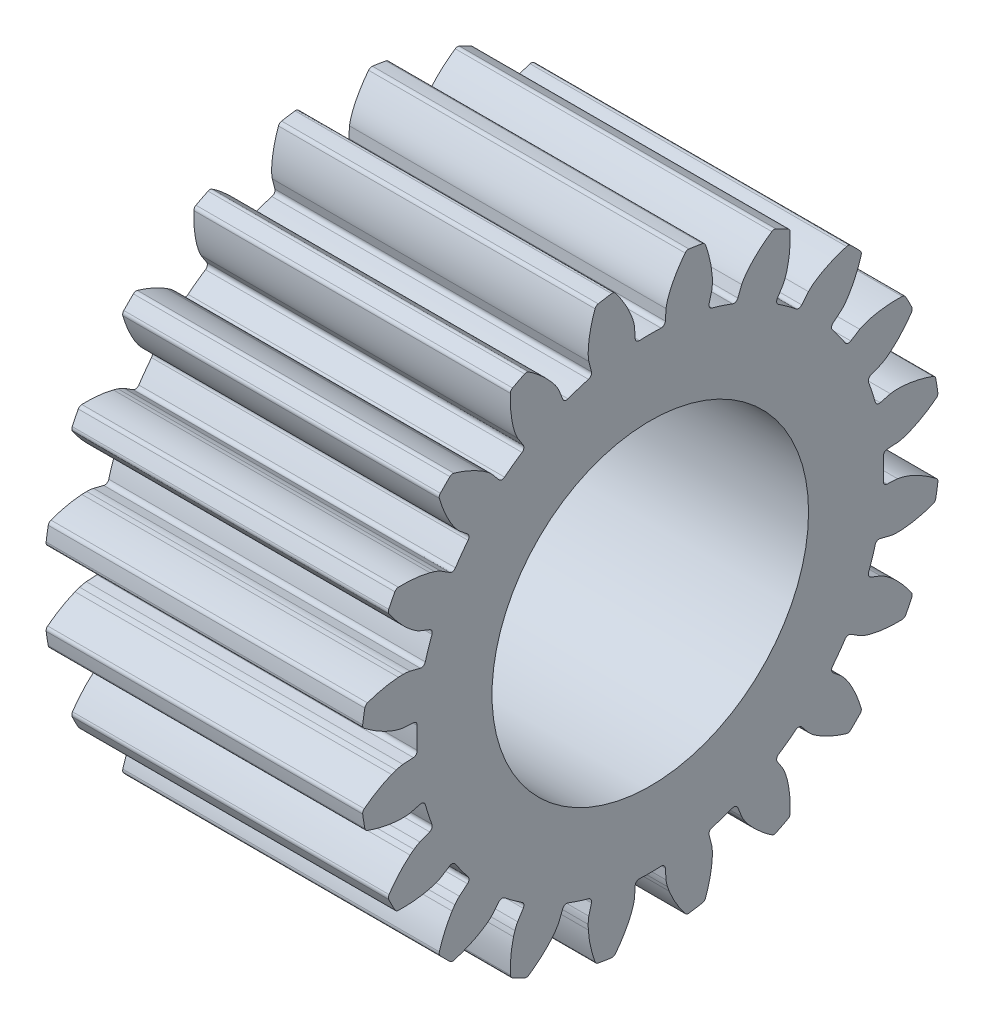
from build123d import *

# Parameters (mm, degrees)
SKETCH2_R                      = 11.641666667
SKETCH2_R_2                    = 6.35
GEAR_WIDTH_EXTRUDE_DEPTH       = 12.7
GEAR_TOOTH_CUT_DEPTH           = 25.4
TOOTH_FILLETS_R                = 0.166158333
CIRPATTERN1_COUNT              = 20
CIRPATTERN1_COPY_1_DEPTH       = 25.4
CIRPATTERN1_COPY_2_DEPTH       = 25.4
CIRPATTERN1_COPY_3_DEPTH       = 25.4
CIRPATTERN1_COPY_4_DEPTH       = 25.4
CIRPATTERN1_COPY_5_DEPTH       = 25.4
CIRPATTERN1_COPY_6_DEPTH       = 25.4
CIRPATTERN1_COPY_7_DEPTH       = 25.4
CIRPATTERN1_COPY_8_DEPTH       = 25.4
CIRPATTERN1_COPY_9_DEPTH       = 25.4
CIRPATTERN1_COPY_10_DEPTH      = 25.4
CIRPATTERN1_COPY_11_DEPTH      = 25.4
CIRPATTERN1_COPY_12_DEPTH      = 25.4
CIRPATTERN1_COPY_13_DEPTH      = 25.4
CIRPATTERN1_COPY_14_DEPTH      = 25.4
CIRPATTERN1_COPY_15_DEPTH      = 25.4
CIRPATTERN1_COPY_16_DEPTH      = 25.4
CIRPATTERN1_COPY_17_DEPTH      = 25.4
CIRPATTERN1_COPY_18_DEPTH      = 25.4
CIRPATTERN1_COPY_19_DEPTH      = 25.4
TOOTH_FILLETS_OF_CIRPATTERN1_R = 0.166158333


with BuildPart() as part:
    # Sketch2 → Gear Width Extrude (new body)
    with BuildSketch(Plane.YZ):
        with Locations(Location((0, 0, 0), (0, 0, 270))):
            Circle(SKETCH2_R)
        with Locations(Location((0, 0, 0), (0, 0, 270))):
            Circle(SKETCH2_R_2, mode=Mode.SUBTRACT)
    extrude(amount=GEAR_WIDTH_EXTRUDE_DEPTH)

    # Sketch3 → Gear Tooth Cut (cut)
    with BuildSketch(Plane.YZ):
        with BuildLine():
            Line((9.358841667, 0), (11.641666667, 0))
            ThreePointArc((11.641666667, 0), (11.618756416, 0.730001453), (11.550115837, 1.457129688))
            add(Edge.make_bspline(
                [(9.924950887, 0.632432444), (9.927665709, 0.632640558), (9.935271977, 0.633332523), (9.958708221, 0.636167814), (10.004748972, 0.643723264), (10.061265669, 0.655862457), (10.125884242, 0.672498541), (10.18790775, 0.690656099), (10.240712879, 0.707481051), (10.293164878, 0.725471798), (10.345204029, 0.744480059), (10.407974795, 0.768785256), (10.482864008, 0.799706671), (10.56980499, 0.838426343), (10.667678091, 0.885373081), (10.76659038, 0.936443394), (10.863213861, 0.989339672), (10.959973929, 1.045801989), (11.052977814, 1.102569368), (11.148631538, 1.16459707), (11.236446312, 1.223412483), (11.333722057, 1.292669638), (11.411905495, 1.349545176), (11.49170588, 1.411081623), (11.530401372, 1.441441608), (11.550115837, 1.457129688)],
                knots=[0, 0, 0, 0, 0, 0.005376749, 0.015083688, 0.04661014, 0.092110526, 0.119476176, 0.146842496, 0.174208854, 0.201574956, 0.228941013, 0.256307345, 0.307035032, 0.361767352, 0.416499661, 0.471231937, 0.525964282, 0.580696616, 0.635428982, 0.690161387, 0.744893688, 0.799626082, 0.854358407, 0.909090915, 0.909090915, 0.909090915, 0.909090915, 0.909090915], degree=4))
            Line((9.924950887, 0.632432444), (9.339898894, 0.595152072))
            ThreePointArc((9.339898894, 0.595152072), (9.354104775, 0.297726728), (9.358841667, 0))
        make_face()
    gear_tooth_cut = extrude(amount=GEAR_TOOTH_CUT_DEPTH, mode=Mode.SUBTRACT)

    # Gear Tooth Cut Mirror: Gear Tooth Cut across Front Plane
    add(gear_tooth_cut.mirror(Plane.XY), mode=Mode.SUBTRACT)

    # Tooth Fillets
    tooth_fillets_edges = [part.edges().sort_by_distance(p)[0] for p in [
        (6.35, 11.550115837, 1.457129688),
        (6.35, 11.550115837, -1.457129688),
        (6.35, 9.339898894, 0.595152072),
        (6.35, 9.339898894, -0.595152072),
    ]]
    fillet(tooth_fillets_edges, radius=TOOTH_FILLETS_R)

    # CirPattern1: Gear Tooth Cut ×20 about axis
    cirpattern1_axis = Axis((0, 0, 0), (1, 0, 0))
    for i in range(1, CIRPATTERN1_COUNT):
        add(gear_tooth_cut.rotate(cirpattern1_axis, i * 360 / CIRPATTERN1_COUNT), mode=Mode.SUBTRACT)

    # CirPattern1 copy 1 sketch → CirPattern1 copy 1 (cut)
    with BuildSketch(Plane(origin=(0, 0, 0), x_dir=(0, 0.9510565162951535, 0.3090169943749474), z_dir=(1, 0, 0))):
        with BuildLine():
            Line((9.358841667, 0), (11.641666667, 0))
            ThreePointArc((11.641666667, 0), (11.618756416, -0.730001453), (11.550115837, -1.457129688))
            add(Edge.make_bspline(
                [(9.924950887, -0.632432444), (9.927665709, -0.632640558), (9.935271977, -0.633332523), (9.958708221, -0.636167814), (10.004748972, -0.643723264), (10.061265669, -0.655862457), (10.125884242, -0.672498541), (10.18790775, -0.690656099), (10.240712879, -0.707481051), (10.293164878, -0.725471798), (10.345204029, -0.744480059), (10.407974795, -0.768785256), (10.482864008, -0.799706671), (10.56980499, -0.838426343), (10.667678091, -0.885373081), (10.76659038, -0.936443394), (10.863213861, -0.989339672), (10.959973929, -1.045801989), (11.052977814, -1.102569368), (11.148631538, -1.16459707), (11.236446312, -1.223412483), (11.333722057, -1.292669638), (11.411905495, -1.349545176), (11.49170588, -1.411081623), (11.530401372, -1.441441608), (11.550115837, -1.457129688)],
                knots=[0, 0, 0, 0, 0, 0.005376749, 0.015083688, 0.04661014, 0.092110526, 0.119476176, 0.146842496, 0.174208854, 0.201574956, 0.228941013, 0.256307345, 0.307035032, 0.361767352, 0.416499661, 0.471231937, 0.525964282, 0.580696616, 0.635428982, 0.690161387, 0.744893688, 0.799626082, 0.854358407, 0.909090915, 0.909090915, 0.909090915, 0.909090915, 0.909090915], degree=4))
            Line((9.924950887, -0.632432444), (9.339898894, -0.595152072))
            ThreePointArc((9.339898894, -0.595152072), (9.354104775, -0.297726728), (9.358841667, 0))
        make_face()
    extrude(amount=CIRPATTERN1_COPY_1_DEPTH, mode=Mode.SUBTRACT)

    # CirPattern1 copy 2 sketch → CirPattern1 copy 2 (cut)
    with BuildSketch(Plane(origin=(0, 0, 0), x_dir=(0, 0.8090169943749475, 0.5877852522924731), z_dir=(1, 0, 0))):
        with BuildLine():
            Line((9.358841667, 0), (11.641666667, 0))
            ThreePointArc((11.641666667, 0), (11.618756416, -0.730001453), (11.550115837, -1.457129688))
            add(Edge.make_bspline(
                [(9.924950887, -0.632432444), (9.927665709, -0.632640558), (9.935271977, -0.633332523), (9.958708221, -0.636167814), (10.004748972, -0.643723264), (10.061265669, -0.655862457), (10.125884242, -0.672498541), (10.18790775, -0.690656099), (10.240712879, -0.707481051), (10.293164878, -0.725471798), (10.345204029, -0.744480059), (10.407974795, -0.768785256), (10.482864008, -0.799706671), (10.56980499, -0.838426343), (10.667678091, -0.885373081), (10.76659038, -0.936443394), (10.863213861, -0.989339672), (10.959973929, -1.045801989), (11.052977814, -1.102569368), (11.148631538, -1.16459707), (11.236446312, -1.223412483), (11.333722057, -1.292669638), (11.411905495, -1.349545176), (11.49170588, -1.411081623), (11.530401372, -1.441441608), (11.550115837, -1.457129688)],
                knots=[0, 0, 0, 0, 0, 0.005376749, 0.015083688, 0.04661014, 0.092110526, 0.119476176, 0.146842496, 0.174208854, 0.201574956, 0.228941013, 0.256307345, 0.307035032, 0.361767352, 0.416499661, 0.471231937, 0.525964282, 0.580696616, 0.635428982, 0.690161387, 0.744893688, 0.799626082, 0.854358407, 0.909090915, 0.909090915, 0.909090915, 0.909090915, 0.909090915], degree=4))
            Line((9.924950887, -0.632432444), (9.339898894, -0.595152072))
            ThreePointArc((9.339898894, -0.595152072), (9.354104775, -0.297726728), (9.358841667, 0))
        make_face()
    extrude(amount=CIRPATTERN1_COPY_2_DEPTH, mode=Mode.SUBTRACT)

    # CirPattern1 copy 3 sketch → CirPattern1 copy 3 (cut)
    with BuildSketch(Plane(origin=(0, 0, 0), x_dir=(0, 0.5877852522924731, 0.8090169943749475), z_dir=(1, 0, 0))):
        with BuildLine():
            Line((9.358841667, 0), (11.641666667, 0))
            ThreePointArc((11.641666667, 0), (11.618756416, -0.730001453), (11.550115837, -1.457129688))
            add(Edge.make_bspline(
                [(9.924950887, -0.632432444), (9.927665709, -0.632640558), (9.935271977, -0.633332523), (9.958708221, -0.636167814), (10.004748972, -0.643723264), (10.061265669, -0.655862457), (10.125884242, -0.672498541), (10.18790775, -0.690656099), (10.240712879, -0.707481051), (10.293164878, -0.725471798), (10.345204029, -0.744480059), (10.407974795, -0.768785256), (10.482864008, -0.799706671), (10.56980499, -0.838426343), (10.667678091, -0.885373081), (10.76659038, -0.936443394), (10.863213861, -0.989339672), (10.959973929, -1.045801989), (11.052977814, -1.102569368), (11.148631538, -1.16459707), (11.236446312, -1.223412483), (11.333722057, -1.292669638), (11.411905495, -1.349545176), (11.49170588, -1.411081623), (11.530401372, -1.441441608), (11.550115837, -1.457129688)],
                knots=[0, 0, 0, 0, 0, 0.005376749, 0.015083688, 0.04661014, 0.092110526, 0.119476176, 0.146842496, 0.174208854, 0.201574956, 0.228941013, 0.256307345, 0.307035032, 0.361767352, 0.416499661, 0.471231937, 0.525964282, 0.580696616, 0.635428982, 0.690161387, 0.744893688, 0.799626082, 0.854358407, 0.909090915, 0.909090915, 0.909090915, 0.909090915, 0.909090915], degree=4))
            Line((9.924950887, -0.632432444), (9.339898894, -0.595152072))
            ThreePointArc((9.339898894, -0.595152072), (9.354104775, -0.297726728), (9.358841667, 0))
        make_face()
    extrude(amount=CIRPATTERN1_COPY_3_DEPTH, mode=Mode.SUBTRACT)

    # CirPattern1 copy 4 sketch → CirPattern1 copy 4 (cut)
    with BuildSketch(Plane(origin=(0, 0, 0), x_dir=(0, 0.30901699437494745, 0.9510565162951535), z_dir=(1, 0, 0))):
        with BuildLine():
            Line((9.358841667, 0), (11.641666667, 0))
            ThreePointArc((11.641666667, 0), (11.618756416, -0.730001453), (11.550115837, -1.457129688))
            add(Edge.make_bspline(
                [(9.924950887, -0.632432444), (9.927665709, -0.632640558), (9.935271977, -0.633332523), (9.958708221, -0.636167814), (10.004748972, -0.643723264), (10.061265669, -0.655862457), (10.125884242, -0.672498541), (10.18790775, -0.690656099), (10.240712879, -0.707481051), (10.293164878, -0.725471798), (10.345204029, -0.744480059), (10.407974795, -0.768785256), (10.482864008, -0.799706671), (10.56980499, -0.838426343), (10.667678091, -0.885373081), (10.76659038, -0.936443394), (10.863213861, -0.989339672), (10.959973929, -1.045801989), (11.052977814, -1.102569368), (11.148631538, -1.16459707), (11.236446312, -1.223412483), (11.333722057, -1.292669638), (11.411905495, -1.349545176), (11.49170588, -1.411081623), (11.530401372, -1.441441608), (11.550115837, -1.457129688)],
                knots=[0, 0, 0, 0, 0, 0.005376749, 0.015083688, 0.04661014, 0.092110526, 0.119476176, 0.146842496, 0.174208854, 0.201574956, 0.228941013, 0.256307345, 0.307035032, 0.361767352, 0.416499661, 0.471231937, 0.525964282, 0.580696616, 0.635428982, 0.690161387, 0.744893688, 0.799626082, 0.854358407, 0.909090915, 0.909090915, 0.909090915, 0.909090915, 0.909090915], degree=4))
            Line((9.924950887, -0.632432444), (9.339898894, -0.595152072))
            ThreePointArc((9.339898894, -0.595152072), (9.354104775, -0.297726728), (9.358841667, 0))
        make_face()
    extrude(amount=CIRPATTERN1_COPY_4_DEPTH, mode=Mode.SUBTRACT)

    # CirPattern1 copy 5 sketch → CirPattern1 copy 5 (cut)
    with BuildSketch(Plane(origin=(0, 0, 0), x_dir=(0, 0, 1), z_dir=(1, 0, 0))):
        with BuildLine():
            Line((9.358841667, 0), (11.641666667, 0))
            ThreePointArc((11.641666667, 0), (11.618756416, -0.730001453), (11.550115837, -1.457129688))
            add(Edge.make_bspline(
                [(9.924950887, -0.632432444), (9.927665709, -0.632640558), (9.935271977, -0.633332523), (9.958708221, -0.636167814), (10.004748972, -0.643723264), (10.061265669, -0.655862457), (10.125884242, -0.672498541), (10.18790775, -0.690656099), (10.240712879, -0.707481051), (10.293164878, -0.725471798), (10.345204029, -0.744480059), (10.407974795, -0.768785256), (10.482864008, -0.799706671), (10.56980499, -0.838426343), (10.667678091, -0.885373081), (10.76659038, -0.936443394), (10.863213861, -0.989339672), (10.959973929, -1.045801989), (11.052977814, -1.102569368), (11.148631538, -1.16459707), (11.236446312, -1.223412483), (11.333722057, -1.292669638), (11.411905495, -1.349545176), (11.49170588, -1.411081623), (11.530401372, -1.441441608), (11.550115837, -1.457129688)],
                knots=[0, 0, 0, 0, 0, 0.005376749, 0.015083688, 0.04661014, 0.092110526, 0.119476176, 0.146842496, 0.174208854, 0.201574956, 0.228941013, 0.256307345, 0.307035032, 0.361767352, 0.416499661, 0.471231937, 0.525964282, 0.580696616, 0.635428982, 0.690161387, 0.744893688, 0.799626082, 0.854358407, 0.909090915, 0.909090915, 0.909090915, 0.909090915, 0.909090915], degree=4))
            Line((9.924950887, -0.632432444), (9.339898894, -0.595152072))
            ThreePointArc((9.339898894, -0.595152072), (9.354104775, -0.297726728), (9.358841667, 0))
        make_face()
    extrude(amount=CIRPATTERN1_COPY_5_DEPTH, mode=Mode.SUBTRACT)

    # CirPattern1 copy 6 sketch → CirPattern1 copy 6 (cut)
    with BuildSketch(Plane(origin=(0, 0, 0), x_dir=(0, -0.30901699437494734, 0.9510565162951536), z_dir=(1, 0, 0))):
        with BuildLine():
            Line((9.358841667, 0), (11.641666667, 0))
            ThreePointArc((11.641666667, 0), (11.618756416, -0.730001453), (11.550115837, -1.457129688))
            add(Edge.make_bspline(
                [(9.924950887, -0.632432444), (9.927665709, -0.632640558), (9.935271977, -0.633332523), (9.958708221, -0.636167814), (10.004748972, -0.643723264), (10.061265669, -0.655862457), (10.125884242, -0.672498541), (10.18790775, -0.690656099), (10.240712879, -0.707481051), (10.293164878, -0.725471798), (10.345204029, -0.744480059), (10.407974795, -0.768785256), (10.482864008, -0.799706671), (10.56980499, -0.838426343), (10.667678091, -0.885373081), (10.76659038, -0.936443394), (10.863213861, -0.989339672), (10.959973929, -1.045801989), (11.052977814, -1.102569368), (11.148631538, -1.16459707), (11.236446312, -1.223412483), (11.333722057, -1.292669638), (11.411905495, -1.349545176), (11.49170588, -1.411081623), (11.530401372, -1.441441608), (11.550115837, -1.457129688)],
                knots=[0, 0, 0, 0, 0, 0.005376749, 0.015083688, 0.04661014, 0.092110526, 0.119476176, 0.146842496, 0.174208854, 0.201574956, 0.228941013, 0.256307345, 0.307035032, 0.361767352, 0.416499661, 0.471231937, 0.525964282, 0.580696616, 0.635428982, 0.690161387, 0.744893688, 0.799626082, 0.854358407, 0.909090915, 0.909090915, 0.909090915, 0.909090915, 0.909090915], degree=4))
            Line((9.924950887, -0.632432444), (9.339898894, -0.595152072))
            ThreePointArc((9.339898894, -0.595152072), (9.354104775, -0.297726728), (9.358841667, 0))
        make_face()
    extrude(amount=CIRPATTERN1_COPY_6_DEPTH, mode=Mode.SUBTRACT)

    # CirPattern1 copy 7 sketch → CirPattern1 copy 7 (cut)
    with BuildSketch(Plane(origin=(0, 0, 0), x_dir=(0, -0.587785252292473, 0.8090169943749475), z_dir=(1, 0, 0))):
        with BuildLine():
            Line((9.358841667, 0), (11.641666667, 0))
            ThreePointArc((11.641666667, 0), (11.618756416, -0.730001453), (11.550115837, -1.457129688))
            add(Edge.make_bspline(
                [(9.924950887, -0.632432444), (9.927665709, -0.632640558), (9.935271977, -0.633332523), (9.958708221, -0.636167814), (10.004748972, -0.643723264), (10.061265669, -0.655862457), (10.125884242, -0.672498541), (10.18790775, -0.690656099), (10.240712879, -0.707481051), (10.293164878, -0.725471798), (10.345204029, -0.744480059), (10.407974795, -0.768785256), (10.482864008, -0.799706671), (10.56980499, -0.838426343), (10.667678091, -0.885373081), (10.76659038, -0.936443394), (10.863213861, -0.989339672), (10.959973929, -1.045801989), (11.052977814, -1.102569368), (11.148631538, -1.16459707), (11.236446312, -1.223412483), (11.333722057, -1.292669638), (11.411905495, -1.349545176), (11.49170588, -1.411081623), (11.530401372, -1.441441608), (11.550115837, -1.457129688)],
                knots=[0, 0, 0, 0, 0, 0.005376749, 0.015083688, 0.04661014, 0.092110526, 0.119476176, 0.146842496, 0.174208854, 0.201574956, 0.228941013, 0.256307345, 0.307035032, 0.361767352, 0.416499661, 0.471231937, 0.525964282, 0.580696616, 0.635428982, 0.690161387, 0.744893688, 0.799626082, 0.854358407, 0.909090915, 0.909090915, 0.909090915, 0.909090915, 0.909090915], degree=4))
            Line((9.924950887, -0.632432444), (9.339898894, -0.595152072))
            ThreePointArc((9.339898894, -0.595152072), (9.354104775, -0.297726728), (9.358841667, 0))
        make_face()
    extrude(amount=CIRPATTERN1_COPY_7_DEPTH, mode=Mode.SUBTRACT)

    # CirPattern1 copy 8 sketch → CirPattern1 copy 8 (cut)
    with BuildSketch(Plane(origin=(0, 0, 0), x_dir=(0, -0.8090169943749473, 0.5877852522924732), z_dir=(1, 0, 0))):
        with BuildLine():
            Line((9.358841667, 0), (11.641666667, 0))
            ThreePointArc((11.641666667, 0), (11.618756416, -0.730001453), (11.550115837, -1.457129688))
            add(Edge.make_bspline(
                [(9.924950887, -0.632432444), (9.927665709, -0.632640558), (9.935271977, -0.633332523), (9.958708221, -0.636167814), (10.004748972, -0.643723264), (10.061265669, -0.655862457), (10.125884242, -0.672498541), (10.18790775, -0.690656099), (10.240712879, -0.707481051), (10.293164878, -0.725471798), (10.345204029, -0.744480059), (10.407974795, -0.768785256), (10.482864008, -0.799706671), (10.56980499, -0.838426343), (10.667678091, -0.885373081), (10.76659038, -0.936443394), (10.863213861, -0.989339672), (10.959973929, -1.045801989), (11.052977814, -1.102569368), (11.148631538, -1.16459707), (11.236446312, -1.223412483), (11.333722057, -1.292669638), (11.411905495, -1.349545176), (11.49170588, -1.411081623), (11.530401372, -1.441441608), (11.550115837, -1.457129688)],
                knots=[0, 0, 0, 0, 0, 0.005376749, 0.015083688, 0.04661014, 0.092110526, 0.119476176, 0.146842496, 0.174208854, 0.201574956, 0.228941013, 0.256307345, 0.307035032, 0.361767352, 0.416499661, 0.471231937, 0.525964282, 0.580696616, 0.635428982, 0.690161387, 0.744893688, 0.799626082, 0.854358407, 0.909090915, 0.909090915, 0.909090915, 0.909090915, 0.909090915], degree=4))
            Line((9.924950887, -0.632432444), (9.339898894, -0.595152072))
            ThreePointArc((9.339898894, -0.595152072), (9.354104775, -0.297726728), (9.358841667, 0))
        make_face()
    extrude(amount=CIRPATTERN1_COPY_8_DEPTH, mode=Mode.SUBTRACT)

    # CirPattern1 copy 9 sketch → CirPattern1 copy 9 (cut)
    with BuildSketch(Plane(origin=(0, 0, 0), x_dir=(0, -0.9510565162951535, 0.3090169943749475), z_dir=(1, 0, 0))):
        with BuildLine():
            Line((9.358841667, 0), (11.641666667, 0))
            ThreePointArc((11.641666667, 0), (11.618756416, -0.730001453), (11.550115837, -1.457129688))
            add(Edge.make_bspline(
                [(9.924950887, -0.632432444), (9.927665709, -0.632640558), (9.935271977, -0.633332523), (9.958708221, -0.636167814), (10.004748972, -0.643723264), (10.061265669, -0.655862457), (10.125884242, -0.672498541), (10.18790775, -0.690656099), (10.240712879, -0.707481051), (10.293164878, -0.725471798), (10.345204029, -0.744480059), (10.407974795, -0.768785256), (10.482864008, -0.799706671), (10.56980499, -0.838426343), (10.667678091, -0.885373081), (10.76659038, -0.936443394), (10.863213861, -0.989339672), (10.959973929, -1.045801989), (11.052977814, -1.102569368), (11.148631538, -1.16459707), (11.236446312, -1.223412483), (11.333722057, -1.292669638), (11.411905495, -1.349545176), (11.49170588, -1.411081623), (11.530401372, -1.441441608), (11.550115837, -1.457129688)],
                knots=[0, 0, 0, 0, 0, 0.005376749, 0.015083688, 0.04661014, 0.092110526, 0.119476176, 0.146842496, 0.174208854, 0.201574956, 0.228941013, 0.256307345, 0.307035032, 0.361767352, 0.416499661, 0.471231937, 0.525964282, 0.580696616, 0.635428982, 0.690161387, 0.744893688, 0.799626082, 0.854358407, 0.909090915, 0.909090915, 0.909090915, 0.909090915, 0.909090915], degree=4))
            Line((9.924950887, -0.632432444), (9.339898894, -0.595152072))
            ThreePointArc((9.339898894, -0.595152072), (9.354104775, -0.297726728), (9.358841667, 0))
        make_face()
    extrude(amount=CIRPATTERN1_COPY_9_DEPTH, mode=Mode.SUBTRACT)

    # CirPattern1 copy 10 sketch → CirPattern1 copy 10 (cut)
    with BuildSketch(Plane(origin=(0, 0, 0), x_dir=(0, -1, 0), z_dir=(1, 0, 0))):
        with BuildLine():
            Line((9.358841667, 0), (11.641666667, 0))
            ThreePointArc((11.641666667, 0), (11.618756416, -0.730001453), (11.550115837, -1.457129688))
            add(Edge.make_bspline(
                [(9.924950887, -0.632432444), (9.927665709, -0.632640558), (9.935271977, -0.633332523), (9.958708221, -0.636167814), (10.004748972, -0.643723264), (10.061265669, -0.655862457), (10.125884242, -0.672498541), (10.18790775, -0.690656099), (10.240712879, -0.707481051), (10.293164878, -0.725471798), (10.345204029, -0.744480059), (10.407974795, -0.768785256), (10.482864008, -0.799706671), (10.56980499, -0.838426343), (10.667678091, -0.885373081), (10.76659038, -0.936443394), (10.863213861, -0.989339672), (10.959973929, -1.045801989), (11.052977814, -1.102569368), (11.148631538, -1.16459707), (11.236446312, -1.223412483), (11.333722057, -1.292669638), (11.411905495, -1.349545176), (11.49170588, -1.411081623), (11.530401372, -1.441441608), (11.550115837, -1.457129688)],
                knots=[0, 0, 0, 0, 0, 0.005376749, 0.015083688, 0.04661014, 0.092110526, 0.119476176, 0.146842496, 0.174208854, 0.201574956, 0.228941013, 0.256307345, 0.307035032, 0.361767352, 0.416499661, 0.471231937, 0.525964282, 0.580696616, 0.635428982, 0.690161387, 0.744893688, 0.799626082, 0.854358407, 0.909090915, 0.909090915, 0.909090915, 0.909090915, 0.909090915], degree=4))
            Line((9.924950887, -0.632432444), (9.339898894, -0.595152072))
            ThreePointArc((9.339898894, -0.595152072), (9.354104775, -0.297726728), (9.358841667, 0))
        make_face()
    extrude(amount=CIRPATTERN1_COPY_10_DEPTH, mode=Mode.SUBTRACT)

    # CirPattern1 copy 11 sketch → CirPattern1 copy 11 (cut)
    with BuildSketch(Plane(origin=(0, 0, 0), x_dir=(0, -0.9510565162951536, -0.3090169943749473), z_dir=(1, 0, 0))):
        with BuildLine():
            Line((9.358841667, 0), (11.641666667, 0))
            ThreePointArc((11.641666667, 0), (11.618756416, -0.730001453), (11.550115837, -1.457129688))
            add(Edge.make_bspline(
                [(9.924950887, -0.632432444), (9.927665709, -0.632640558), (9.935271977, -0.633332523), (9.958708221, -0.636167814), (10.004748972, -0.643723264), (10.061265669, -0.655862457), (10.125884242, -0.672498541), (10.18790775, -0.690656099), (10.240712879, -0.707481051), (10.293164878, -0.725471798), (10.345204029, -0.744480059), (10.407974795, -0.768785256), (10.482864008, -0.799706671), (10.56980499, -0.838426343), (10.667678091, -0.885373081), (10.76659038, -0.936443394), (10.863213861, -0.989339672), (10.959973929, -1.045801989), (11.052977814, -1.102569368), (11.148631538, -1.16459707), (11.236446312, -1.223412483), (11.333722057, -1.292669638), (11.411905495, -1.349545176), (11.49170588, -1.411081623), (11.530401372, -1.441441608), (11.550115837, -1.457129688)],
                knots=[0, 0, 0, 0, 0, 0.005376749, 0.015083688, 0.04661014, 0.092110526, 0.119476176, 0.146842496, 0.174208854, 0.201574956, 0.228941013, 0.256307345, 0.307035032, 0.361767352, 0.416499661, 0.471231937, 0.525964282, 0.580696616, 0.635428982, 0.690161387, 0.744893688, 0.799626082, 0.854358407, 0.909090915, 0.909090915, 0.909090915, 0.909090915, 0.909090915], degree=4))
            Line((9.924950887, -0.632432444), (9.339898894, -0.595152072))
            ThreePointArc((9.339898894, -0.595152072), (9.354104775, -0.297726728), (9.358841667, 0))
        make_face()
    extrude(amount=CIRPATTERN1_COPY_11_DEPTH, mode=Mode.SUBTRACT)

    # CirPattern1 copy 12 sketch → CirPattern1 copy 12 (cut)
    with BuildSketch(Plane(origin=(0, 0, 0), x_dir=(0, -0.8090169943749476, -0.587785252292473), z_dir=(1, 0, 0))):
        with BuildLine():
            Line((9.358841667, 0), (11.641666667, 0))
            ThreePointArc((11.641666667, 0), (11.618756416, -0.730001453), (11.550115837, -1.457129688))
            add(Edge.make_bspline(
                [(9.924950887, -0.632432444), (9.927665709, -0.632640558), (9.935271977, -0.633332523), (9.958708221, -0.636167814), (10.004748972, -0.643723264), (10.061265669, -0.655862457), (10.125884242, -0.672498541), (10.18790775, -0.690656099), (10.240712879, -0.707481051), (10.293164878, -0.725471798), (10.345204029, -0.744480059), (10.407974795, -0.768785256), (10.482864008, -0.799706671), (10.56980499, -0.838426343), (10.667678091, -0.885373081), (10.76659038, -0.936443394), (10.863213861, -0.989339672), (10.959973929, -1.045801989), (11.052977814, -1.102569368), (11.148631538, -1.16459707), (11.236446312, -1.223412483), (11.333722057, -1.292669638), (11.411905495, -1.349545176), (11.49170588, -1.411081623), (11.530401372, -1.441441608), (11.550115837, -1.457129688)],
                knots=[0, 0, 0, 0, 0, 0.005376749, 0.015083688, 0.04661014, 0.092110526, 0.119476176, 0.146842496, 0.174208854, 0.201574956, 0.228941013, 0.256307345, 0.307035032, 0.361767352, 0.416499661, 0.471231937, 0.525964282, 0.580696616, 0.635428982, 0.690161387, 0.744893688, 0.799626082, 0.854358407, 0.909090915, 0.909090915, 0.909090915, 0.909090915, 0.909090915], degree=4))
            Line((9.924950887, -0.632432444), (9.339898894, -0.595152072))
            ThreePointArc((9.339898894, -0.595152072), (9.354104775, -0.297726728), (9.358841667, 0))
        make_face()
    extrude(amount=CIRPATTERN1_COPY_12_DEPTH, mode=Mode.SUBTRACT)

    # CirPattern1 copy 13 sketch → CirPattern1 copy 13 (cut)
    with BuildSketch(Plane(origin=(0, 0, 0), x_dir=(0, -0.5877852522924732, -0.8090169943749473), z_dir=(1, 0, 0))):
        with BuildLine():
            Line((9.358841667, 0), (11.641666667, 0))
            ThreePointArc((11.641666667, 0), (11.618756416, -0.730001453), (11.550115837, -1.457129688))
            add(Edge.make_bspline(
                [(9.924950887, -0.632432444), (9.927665709, -0.632640558), (9.935271977, -0.633332523), (9.958708221, -0.636167814), (10.004748972, -0.643723264), (10.061265669, -0.655862457), (10.125884242, -0.672498541), (10.18790775, -0.690656099), (10.240712879, -0.707481051), (10.293164878, -0.725471798), (10.345204029, -0.744480059), (10.407974795, -0.768785256), (10.482864008, -0.799706671), (10.56980499, -0.838426343), (10.667678091, -0.885373081), (10.76659038, -0.936443394), (10.863213861, -0.989339672), (10.959973929, -1.045801989), (11.052977814, -1.102569368), (11.148631538, -1.16459707), (11.236446312, -1.223412483), (11.333722057, -1.292669638), (11.411905495, -1.349545176), (11.49170588, -1.411081623), (11.530401372, -1.441441608), (11.550115837, -1.457129688)],
                knots=[0, 0, 0, 0, 0, 0.005376749, 0.015083688, 0.04661014, 0.092110526, 0.119476176, 0.146842496, 0.174208854, 0.201574956, 0.228941013, 0.256307345, 0.307035032, 0.361767352, 0.416499661, 0.471231937, 0.525964282, 0.580696616, 0.635428982, 0.690161387, 0.744893688, 0.799626082, 0.854358407, 0.909090915, 0.909090915, 0.909090915, 0.909090915, 0.909090915], degree=4))
            Line((9.924950887, -0.632432444), (9.339898894, -0.595152072))
            ThreePointArc((9.339898894, -0.595152072), (9.354104775, -0.297726728), (9.358841667, 0))
        make_face()
    extrude(amount=CIRPATTERN1_COPY_13_DEPTH, mode=Mode.SUBTRACT)

    # CirPattern1 copy 14 sketch → CirPattern1 copy 14 (cut)
    with BuildSketch(Plane(origin=(0, 0, 0), x_dir=(0, -0.30901699437494756, -0.9510565162951535), z_dir=(1, 0, 0))):
        with BuildLine():
            Line((9.358841667, 0), (11.641666667, 0))
            ThreePointArc((11.641666667, 0), (11.618756416, -0.730001453), (11.550115837, -1.457129688))
            add(Edge.make_bspline(
                [(9.924950887, -0.632432444), (9.927665709, -0.632640558), (9.935271977, -0.633332523), (9.958708221, -0.636167814), (10.004748972, -0.643723264), (10.061265669, -0.655862457), (10.125884242, -0.672498541), (10.18790775, -0.690656099), (10.240712879, -0.707481051), (10.293164878, -0.725471798), (10.345204029, -0.744480059), (10.407974795, -0.768785256), (10.482864008, -0.799706671), (10.56980499, -0.838426343), (10.667678091, -0.885373081), (10.76659038, -0.936443394), (10.863213861, -0.989339672), (10.959973929, -1.045801989), (11.052977814, -1.102569368), (11.148631538, -1.16459707), (11.236446312, -1.223412483), (11.333722057, -1.292669638), (11.411905495, -1.349545176), (11.49170588, -1.411081623), (11.530401372, -1.441441608), (11.550115837, -1.457129688)],
                knots=[0, 0, 0, 0, 0, 0.005376749, 0.015083688, 0.04661014, 0.092110526, 0.119476176, 0.146842496, 0.174208854, 0.201574956, 0.228941013, 0.256307345, 0.307035032, 0.361767352, 0.416499661, 0.471231937, 0.525964282, 0.580696616, 0.635428982, 0.690161387, 0.744893688, 0.799626082, 0.854358407, 0.909090915, 0.909090915, 0.909090915, 0.909090915, 0.909090915], degree=4))
            Line((9.924950887, -0.632432444), (9.339898894, -0.595152072))
            ThreePointArc((9.339898894, -0.595152072), (9.354104775, -0.297726728), (9.358841667, 0))
        make_face()
    extrude(amount=CIRPATTERN1_COPY_14_DEPTH, mode=Mode.SUBTRACT)

    # CirPattern1 copy 15 sketch → CirPattern1 copy 15 (cut)
    with BuildSketch(Plane(origin=(0, 0, 0), x_dir=(0, 0, -1), z_dir=(1, 0, 0))):
        with BuildLine():
            Line((9.358841667, 0), (11.641666667, 0))
            ThreePointArc((11.641666667, 0), (11.618756416, -0.730001453), (11.550115837, -1.457129688))
            add(Edge.make_bspline(
                [(9.924950887, -0.632432444), (9.927665709, -0.632640558), (9.935271977, -0.633332523), (9.958708221, -0.636167814), (10.004748972, -0.643723264), (10.061265669, -0.655862457), (10.125884242, -0.672498541), (10.18790775, -0.690656099), (10.240712879, -0.707481051), (10.293164878, -0.725471798), (10.345204029, -0.744480059), (10.407974795, -0.768785256), (10.482864008, -0.799706671), (10.56980499, -0.838426343), (10.667678091, -0.885373081), (10.76659038, -0.936443394), (10.863213861, -0.989339672), (10.959973929, -1.045801989), (11.052977814, -1.102569368), (11.148631538, -1.16459707), (11.236446312, -1.223412483), (11.333722057, -1.292669638), (11.411905495, -1.349545176), (11.49170588, -1.411081623), (11.530401372, -1.441441608), (11.550115837, -1.457129688)],
                knots=[0, 0, 0, 0, 0, 0.005376749, 0.015083688, 0.04661014, 0.092110526, 0.119476176, 0.146842496, 0.174208854, 0.201574956, 0.228941013, 0.256307345, 0.307035032, 0.361767352, 0.416499661, 0.471231937, 0.525964282, 0.580696616, 0.635428982, 0.690161387, 0.744893688, 0.799626082, 0.854358407, 0.909090915, 0.909090915, 0.909090915, 0.909090915, 0.909090915], degree=4))
            Line((9.924950887, -0.632432444), (9.339898894, -0.595152072))
            ThreePointArc((9.339898894, -0.595152072), (9.354104775, -0.297726728), (9.358841667, 0))
        make_face()
    extrude(amount=CIRPATTERN1_COPY_15_DEPTH, mode=Mode.SUBTRACT)

    # CirPattern1 copy 16 sketch → CirPattern1 copy 16 (cut)
    with BuildSketch(Plane(origin=(0, 0, 0), x_dir=(0, 0.30901699437494723, -0.9510565162951536), z_dir=(1, 0, 0))):
        with BuildLine():
            Line((9.358841667, 0), (11.641666667, 0))
            ThreePointArc((11.641666667, 0), (11.618756416, -0.730001453), (11.550115837, -1.457129688))
            add(Edge.make_bspline(
                [(9.924950887, -0.632432444), (9.927665709, -0.632640558), (9.935271977, -0.633332523), (9.958708221, -0.636167814), (10.004748972, -0.643723264), (10.061265669, -0.655862457), (10.125884242, -0.672498541), (10.18790775, -0.690656099), (10.240712879, -0.707481051), (10.293164878, -0.725471798), (10.345204029, -0.744480059), (10.407974795, -0.768785256), (10.482864008, -0.799706671), (10.56980499, -0.838426343), (10.667678091, -0.885373081), (10.76659038, -0.936443394), (10.863213861, -0.989339672), (10.959973929, -1.045801989), (11.052977814, -1.102569368), (11.148631538, -1.16459707), (11.236446312, -1.223412483), (11.333722057, -1.292669638), (11.411905495, -1.349545176), (11.49170588, -1.411081623), (11.530401372, -1.441441608), (11.550115837, -1.457129688)],
                knots=[0, 0, 0, 0, 0, 0.005376749, 0.015083688, 0.04661014, 0.092110526, 0.119476176, 0.146842496, 0.174208854, 0.201574956, 0.228941013, 0.256307345, 0.307035032, 0.361767352, 0.416499661, 0.471231937, 0.525964282, 0.580696616, 0.635428982, 0.690161387, 0.744893688, 0.799626082, 0.854358407, 0.909090915, 0.909090915, 0.909090915, 0.909090915, 0.909090915], degree=4))
            Line((9.924950887, -0.632432444), (9.339898894, -0.595152072))
            ThreePointArc((9.339898894, -0.595152072), (9.354104775, -0.297726728), (9.358841667, 0))
        make_face()
    extrude(amount=CIRPATTERN1_COPY_16_DEPTH, mode=Mode.SUBTRACT)

    # CirPattern1 copy 17 sketch → CirPattern1 copy 17 (cut)
    with BuildSketch(Plane(origin=(0, 0, 0), x_dir=(0, 0.5877852522924729, -0.8090169943749476), z_dir=(1, 0, 0))):
        with BuildLine():
            Line((9.358841667, 0), (11.641666667, 0))
            ThreePointArc((11.641666667, 0), (11.618756416, -0.730001453), (11.550115837, -1.457129688))
            add(Edge.make_bspline(
                [(9.924950887, -0.632432444), (9.927665709, -0.632640558), (9.935271977, -0.633332523), (9.958708221, -0.636167814), (10.004748972, -0.643723264), (10.061265669, -0.655862457), (10.125884242, -0.672498541), (10.18790775, -0.690656099), (10.240712879, -0.707481051), (10.293164878, -0.725471798), (10.345204029, -0.744480059), (10.407974795, -0.768785256), (10.482864008, -0.799706671), (10.56980499, -0.838426343), (10.667678091, -0.885373081), (10.76659038, -0.936443394), (10.863213861, -0.989339672), (10.959973929, -1.045801989), (11.052977814, -1.102569368), (11.148631538, -1.16459707), (11.236446312, -1.223412483), (11.333722057, -1.292669638), (11.411905495, -1.349545176), (11.49170588, -1.411081623), (11.530401372, -1.441441608), (11.550115837, -1.457129688)],
                knots=[0, 0, 0, 0, 0, 0.005376749, 0.015083688, 0.04661014, 0.092110526, 0.119476176, 0.146842496, 0.174208854, 0.201574956, 0.228941013, 0.256307345, 0.307035032, 0.361767352, 0.416499661, 0.471231937, 0.525964282, 0.580696616, 0.635428982, 0.690161387, 0.744893688, 0.799626082, 0.854358407, 0.909090915, 0.909090915, 0.909090915, 0.909090915, 0.909090915], degree=4))
            Line((9.924950887, -0.632432444), (9.339898894, -0.595152072))
            ThreePointArc((9.339898894, -0.595152072), (9.354104775, -0.297726728), (9.358841667, 0))
        make_face()
    extrude(amount=CIRPATTERN1_COPY_17_DEPTH, mode=Mode.SUBTRACT)

    # CirPattern1 copy 18 sketch → CirPattern1 copy 18 (cut)
    with BuildSketch(Plane(origin=(0, 0, 0), x_dir=(0, 0.8090169943749473, -0.5877852522924734), z_dir=(1, 0, 0))):
        with BuildLine():
            Line((9.358841667, 0), (11.641666667, 0))
            ThreePointArc((11.641666667, 0), (11.618756416, -0.730001453), (11.550115837, -1.457129688))
            add(Edge.make_bspline(
                [(9.924950887, -0.632432444), (9.927665709, -0.632640558), (9.935271977, -0.633332523), (9.958708221, -0.636167814), (10.004748972, -0.643723264), (10.061265669, -0.655862457), (10.125884242, -0.672498541), (10.18790775, -0.690656099), (10.240712879, -0.707481051), (10.293164878, -0.725471798), (10.345204029, -0.744480059), (10.407974795, -0.768785256), (10.482864008, -0.799706671), (10.56980499, -0.838426343), (10.667678091, -0.885373081), (10.76659038, -0.936443394), (10.863213861, -0.989339672), (10.959973929, -1.045801989), (11.052977814, -1.102569368), (11.148631538, -1.16459707), (11.236446312, -1.223412483), (11.333722057, -1.292669638), (11.411905495, -1.349545176), (11.49170588, -1.411081623), (11.530401372, -1.441441608), (11.550115837, -1.457129688)],
                knots=[0, 0, 0, 0, 0, 0.005376749, 0.015083688, 0.04661014, 0.092110526, 0.119476176, 0.146842496, 0.174208854, 0.201574956, 0.228941013, 0.256307345, 0.307035032, 0.361767352, 0.416499661, 0.471231937, 0.525964282, 0.580696616, 0.635428982, 0.690161387, 0.744893688, 0.799626082, 0.854358407, 0.909090915, 0.909090915, 0.909090915, 0.909090915, 0.909090915], degree=4))
            Line((9.924950887, -0.632432444), (9.339898894, -0.595152072))
            ThreePointArc((9.339898894, -0.595152072), (9.354104775, -0.297726728), (9.358841667, 0))
        make_face()
    extrude(amount=CIRPATTERN1_COPY_18_DEPTH, mode=Mode.SUBTRACT)

    # CirPattern1 copy 19 sketch → CirPattern1 copy 19 (cut)
    with BuildSketch(Plane(origin=(0, 0, 0), x_dir=(0, 0.9510565162951535, -0.3090169943749476), z_dir=(1, 0, 0))):
        with BuildLine():
            Line((9.358841667, 0), (11.641666667, 0))
            ThreePointArc((11.641666667, 0), (11.618756416, -0.730001453), (11.550115837, -1.457129688))
            add(Edge.make_bspline(
                [(9.924950887, -0.632432444), (9.927665709, -0.632640558), (9.935271977, -0.633332523), (9.958708221, -0.636167814), (10.004748972, -0.643723264), (10.061265669, -0.655862457), (10.125884242, -0.672498541), (10.18790775, -0.690656099), (10.240712879, -0.707481051), (10.293164878, -0.725471798), (10.345204029, -0.744480059), (10.407974795, -0.768785256), (10.482864008, -0.799706671), (10.56980499, -0.838426343), (10.667678091, -0.885373081), (10.76659038, -0.936443394), (10.863213861, -0.989339672), (10.959973929, -1.045801989), (11.052977814, -1.102569368), (11.148631538, -1.16459707), (11.236446312, -1.223412483), (11.333722057, -1.292669638), (11.411905495, -1.349545176), (11.49170588, -1.411081623), (11.530401372, -1.441441608), (11.550115837, -1.457129688)],
                knots=[0, 0, 0, 0, 0, 0.005376749, 0.015083688, 0.04661014, 0.092110526, 0.119476176, 0.146842496, 0.174208854, 0.201574956, 0.228941013, 0.256307345, 0.307035032, 0.361767352, 0.416499661, 0.471231937, 0.525964282, 0.580696616, 0.635428982, 0.690161387, 0.744893688, 0.799626082, 0.854358407, 0.909090915, 0.909090915, 0.909090915, 0.909090915, 0.909090915], degree=4))
            Line((9.924950887, -0.632432444), (9.339898894, -0.595152072))
            ThreePointArc((9.339898894, -0.595152072), (9.354104775, -0.297726728), (9.358841667, 0))
        make_face()
    extrude(amount=CIRPATTERN1_COPY_19_DEPTH, mode=Mode.SUBTRACT)

    # Tooth Fillets of CirPattern1
    tooth_fillets_of_cirpattern1_edges = [part.edges().sort_by_distance(p)[0] for p in [
        (6.35, 10.534535094, 4.954994766),
        (6.35, 11.435090767, 2.183369395),
        (6.35, 8.6988596, 3.45221074),
        (6.35, 9.066683809, 2.320164228),
        (6.35, 8.487760658, 7.967830432),
        (6.35, 10.200719341, 5.61014507),
        (6.35, 7.20631532, 5.971342968),
        (6.35, 7.905958542, 5.008366687),
        (6.35, 5.61014507, 10.200719341),
        (6.35, 7.967830432, 8.487760658),
        (6.35, 5.008366687, 7.905958542),
        (6.35, 5.971342968, 7.20631532),
        (6.35, 2.183369395, 11.435090767),
        (6.35, 4.954994766, 10.534535094),
        (6.35, 2.320164228, 9.066683809),
        (6.35, 3.45221074, 8.6988596),
        (6.35, -1.457129688, 11.550115837),
        (6.35, 1.457129688, 11.550115837),
        (6.35, -0.595152072, 9.339898894),
        (6.35, 0.595152072, 9.339898894),
        (6.35, -4.954994766, 10.534535094),
        (6.35, -2.183369395, 11.435090767),
        (6.35, -3.45221074, 8.6988596),
        (6.35, -2.320164228, 9.066683809),
        (6.35, -7.967830432, 8.487760658),
        (6.35, -5.61014507, 10.200719341),
        (6.35, -5.971342968, 7.20631532),
        (6.35, -5.008366687, 7.905958542),
        (6.35, -10.200719341, 5.61014507),
        (6.35, -8.487760658, 7.967830432),
        (6.35, -7.905958542, 5.008366687),
        (6.35, -7.20631532, 5.971342968),
        (6.35, -11.435090767, 2.183369395),
        (6.35, -10.534535094, 4.954994766),
        (6.35, -9.066683809, 2.320164228),
        (6.35, -8.6988596, 3.45221074),
        (6.35, -11.550115837, -1.457129688),
        (6.35, -11.550115837, 1.457129688),
        (6.35, -9.339898894, -0.595152072),
        (6.35, -9.339898894, 0.595152072),
        (6.35, -10.534535094, -4.954994766),
        (6.35, -11.435090767, -2.183369395),
        (6.35, -8.6988596, -3.45221074),
        (6.35, -9.066683809, -2.320164228),
        (6.35, -8.487760658, -7.967830432),
        (6.35, -10.200719341, -5.61014507),
        (6.35, -7.20631532, -5.971342968),
        (6.35, -7.905958542, -5.008366687),
        (6.35, -5.61014507, -10.200719341),
        (6.35, -7.967830432, -8.487760658),
        (6.35, -5.008366687, -7.905958542),
        (6.35, -5.971342968, -7.20631532),
        (6.35, -2.183369395, -11.435090767),
        (6.35, -4.954994766, -10.534535094),
        (6.35, -2.320164228, -9.066683809),
        (6.35, -3.45221074, -8.6988596),
        (6.35, 1.457129688, -11.550115837),
        (6.35, -1.457129688, -11.550115837),
        (6.35, 0.595152072, -9.339898894),
        (6.35, -0.595152072, -9.339898894),
        (6.35, 4.954994766, -10.534535094),
        (6.35, 2.183369395, -11.435090767),
        (6.35, 3.45221074, -8.6988596),
        (6.35, 2.320164228, -9.066683809),
        (6.35, 7.967830432, -8.487760658),
        (6.35, 5.61014507, -10.200719341),
        (6.35, 5.971342968, -7.20631532),
        (6.35, 5.008366687, -7.905958542),
        (6.35, 10.200719341, -5.61014507),
        (6.35, 8.487760658, -7.967830432),
        (6.35, 7.905958542, -5.008366687),
        (6.35, 7.20631532, -5.971342968),
        (6.35, 11.435090767, -2.183369395),
        (6.35, 10.534535094, -4.954994766),
        (6.35, 9.066683809, -2.320164228),
        (6.35, 8.6988596, -3.45221074),
    ]]
    fillet(tooth_fillets_of_cirpattern1_edges, radius=TOOTH_FILLETS_OF_CIRPATTERN1_R)


solid = part.part
